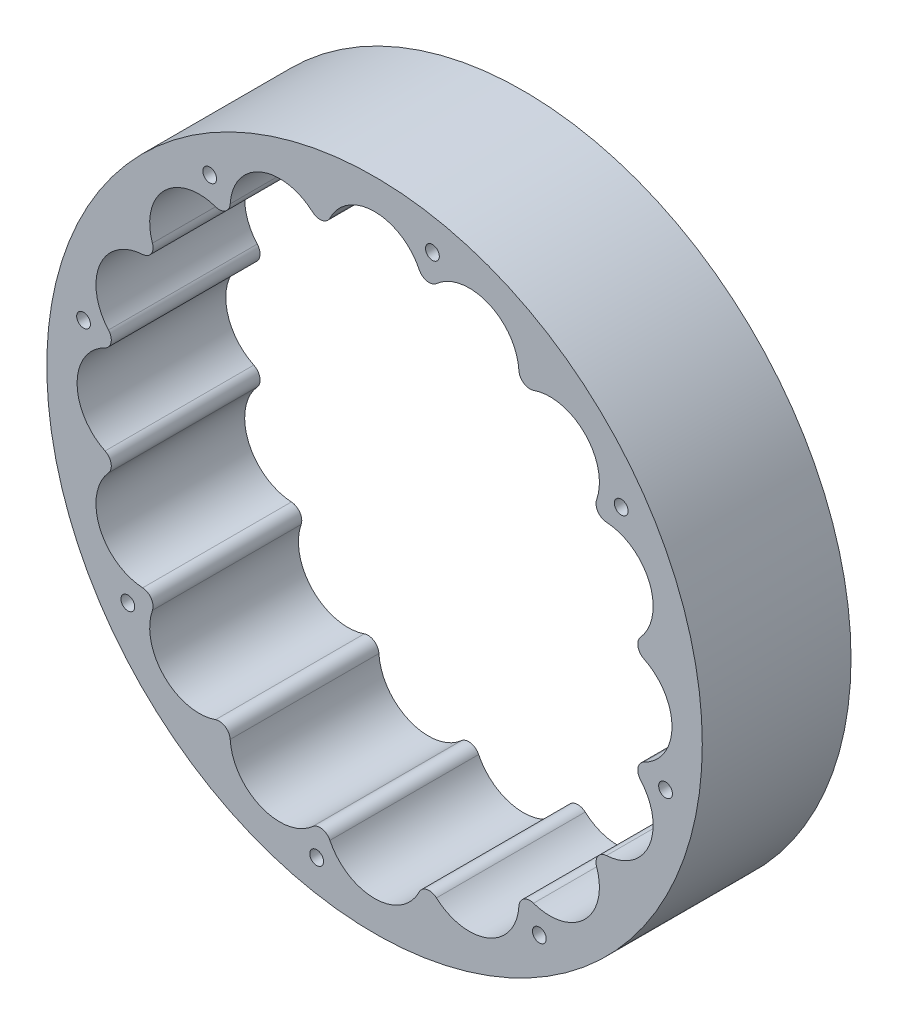
from build123d import *

# Parameters (mm, degrees)
SKETCH1_R           = 59.5
BOSS_EXTRUDE1_DEPTH = 10
SKETCH2_R           = 59.5
BOSS_EXTRUDE3_DEPTH = 27
SKETCH3_R           = 2.025
CUT_EXTRUDE1_DEPTH  = 4
SKETCH4_R           = 23.525
CUT_EXTRUDE2_DEPTH  = 7
SKETCH5_R           = 18
CUT_EXTRUDE3_DEPTH  = 91.755165142
SKETCH6_R           = 1.25
CUT_EXTRUDE4_DEPTH  = 22
FILLET1_R           = 2
SKETCH7_W           = 138.682388438
SKETCH7_H           = 126.163416563
CUT_EXTRUDE5_DEPTH  = 0.01
SKETCH8_R           = 1.5
CUT_EXTRUDE6_DEPTH  = 22
SKETCH9_R           = 58.3
SKETCH9_R_2         = 56.2
CUT_EXTRUDE7_DEPTH  = 2.1


with BuildPart() as part:
    # Sketch1 → Boss-Extrude1 (new body)
    with BuildSketch(Plane.XY):
        Circle(SKETCH1_R)
    extrude(amount=BOSS_EXTRUDE1_DEPTH)

    # Sketch2 → Boss-Extrude3 (add)
    with BuildSketch(Plane.XY.offset(10)):
        Circle(SKETCH2_R)
        with BuildLine():
            ThreePointArc((45.231132339, -8.997031613), (54, 0), (45.231132339, 8.997031613))
            ThreePointArc((45.231132339, 8.997031613), (49.889494756, 20.664905348), (38.345102462, 25.621378334))
            ThreePointArc((38.345102462, 25.621378334), (38.183766184, 38.183766184), (25.621378334, 38.345102462))
            ThreePointArc((25.621378334, 38.345102462), (20.664905348, 49.889494756), (8.997031613, 45.231132339))
            ThreePointArc((8.997031613, 45.231132339), (0, 54), (-8.997031613, 45.231132339))
            ThreePointArc((-8.997031613, 45.231132339), (-20.664905348, 49.889494756), (-25.621378334, 38.345102462))
            ThreePointArc((-25.621378334, 38.345102462), (-38.183766184, 38.183766184), (-38.345102462, 25.621378334))
            ThreePointArc((-38.345102462, 25.621378334), (-49.889494756, 20.664905348), (-45.231132339, 8.997031613))
            ThreePointArc((-45.231132339, 8.997031613), (-54, 0), (-45.231132339, -8.997031613))
            ThreePointArc((-45.231132339, -8.997031613), (-49.889494756, -20.664905348), (-38.345102462, -25.621378334))
            ThreePointArc((-38.345102462, -25.621378334), (-38.183766184, -38.183766184), (-25.621378334, -38.345102462))
            ThreePointArc((-25.621378334, -38.345102462), (-20.664905348, -49.889494756), (-8.997031613, -45.231132339))
            ThreePointArc((-8.997031613, -45.231132339), (0, -54), (8.997031613, -45.231132339))
            ThreePointArc((8.997031613, -45.231132339), (20.664905348, -49.889494756), (25.621378334, -38.345102462))
            ThreePointArc((25.621378334, -38.345102462), (38.183766184, -38.183766184), (38.345102462, -25.621378334))
            ThreePointArc((38.345102462, -25.621378334), (49.889494756, -20.664905348), (45.231132339, -8.997031613))
        make_face(mode=Mode.SUBTRACT)
    extrude(amount=BOSS_EXTRUDE3_DEPTH)

    # Sketch3 → Cut-Extrude1 (cut)
    with BuildSketch(Plane.XY.offset(10)):
        with Locations((45, 0)):
            Circle(SKETCH3_R)
        with Locations((41.574578963, -17.220754456)):
            Circle(SKETCH3_R)
        with Locations((31.819805153, -31.819805153)):
            Circle(SKETCH3_R)
        with Locations((17.220754456, -41.574578963)):
            Circle(SKETCH3_R)
        with Locations((0, -45)):
            Circle(SKETCH3_R)
        with Locations((-17.220754456, -41.574578963)):
            Circle(SKETCH3_R)
        with Locations((-31.819805153, -31.819805153)):
            Circle(SKETCH3_R)
        with Locations((-41.574578963, -17.220754456)):
            Circle(SKETCH3_R)
        with Locations((-45, 0)):
            Circle(SKETCH3_R)
        with Locations((-41.574578963, 17.220754456)):
            Circle(SKETCH3_R)
        with Locations((-31.819805153, 31.819805153)):
            Circle(SKETCH3_R)
        with Locations((-17.220754456, 41.574578963)):
            Circle(SKETCH3_R)
        with Locations((0, 45)):
            Circle(SKETCH3_R)
        with Locations((17.220754456, 41.574578963)):
            Circle(SKETCH3_R)
        with Locations((31.819805153, 31.819805153)):
            Circle(SKETCH3_R)
        with Locations((41.574578963, 17.220754456)):
            Circle(SKETCH3_R)
    extrude(amount=-CUT_EXTRUDE1_DEPTH, mode=Mode.SUBTRACT)

    # Sketch4 → Cut-Extrude2 (cut)
    with BuildSketch(Plane.XY.offset(10)):
        Circle(SKETCH4_R)
    extrude(amount=-CUT_EXTRUDE2_DEPTH, mode=Mode.SUBTRACT)

    # Sketch5 → Cut-Extrude3 (cut, through all)
    with BuildSketch(Plane.XY.offset(3)):
        Circle(SKETCH5_R)
    extrude(amount=-CUT_EXTRUDE3_DEPTH, mode=Mode.SUBTRACT)

    # Sketch6 → Cut-Extrude4 (cut)
    with BuildSketch(Plane.XY.offset(37)):
        with Locations((44.782953319, 29.92301275)):
            Circle(SKETCH6_R)
        with Locations((52.825095203, -10.507564744)):
            Circle(SKETCH6_R)
        with Locations((29.92301275, -44.782953319)):
            Circle(SKETCH6_R)
        with Locations((-10.507564744, -52.825095203)):
            Circle(SKETCH6_R)
        with Locations((-44.782953319, -29.92301275)):
            Circle(SKETCH6_R)
        with Locations((-52.825095203, 10.507564744)):
            Circle(SKETCH6_R)
        with Locations((-29.92301275, 44.782953319)):
            Circle(SKETCH6_R)
        with Locations((10.507564744, 52.825095203)):
            Circle(SKETCH6_R)
    extrude(amount=-CUT_EXTRUDE4_DEPTH, mode=Mode.SUBTRACT)

    # Fillet1
    fillet1_edges = [part.edges().sort_by_distance(p)[0] for p in [
        (45.231132339, -8.997031613, 23.5),
        (45.231132339, 8.997031613, 23.5),
        (38.345102462, 25.621378334, 23.5),
        (25.621378334, 38.345102462, 23.5),
        (8.997031613, 45.231132339, 23.5),
        (-8.997031613, 45.231132339, 23.5),
        (-25.621378334, 38.345102462, 23.5),
        (-38.345102462, 25.621378334, 23.5),
        (-45.231132339, 8.997031613, 23.5),
        (-45.231132339, -8.997031613, 23.5),
        (-38.345102462, -25.621378334, 23.5),
        (-25.621378334, -38.345102462, 23.5),
        (-8.997031613, -45.231132339, 23.5),
        (8.997031613, -45.231132339, 23.5),
        (25.621378334, -38.345102462, 23.5),
        (38.345102462, -25.621378334, 23.5),
    ]]
    fillet(fillet1_edges, radius=FILLET1_R)

    # Sketch7 → Cut-Extrude5 (cut)
    with BuildSketch(Plane.XY.offset(10)):
        with Locations((-4.520739844, -0.904147969)):
            Rectangle(SKETCH7_W, SKETCH7_H)
    extrude(amount=-CUT_EXTRUDE5_DEPTH, mode=Mode.SUBTRACT)


with BuildPart() as cut_extrude5_piece_1:
    # of the separate pieces the step leaves, piece 1, a body of its own (cut_extrude5_pieces)
    add(part.part.solids().sort_by_distance((59.5, 0, 9.99))[0])


with BuildPart() as cut_extrude5_piece_2:
    # of the separate pieces the step leaves, piece 2, a body of its own (cut_extrude5_pieces)
    add(part.part.solids().sort_by_distance((-40.319257579, -28.860192264, 37))[0])

    # Sketch8 → Cut-Extrude6 (cut)
    with BuildSketch(Plane(origin=(0, 0, 10), x_dir=(-1, 0, 0), z_dir=(0, 0, -1))):
        with Locations((44.899359064, 30.000792583)):
            Circle(SKETCH8_R)
        with Locations((52.962405142, -10.534877389)):
            Circle(SKETCH8_R)
        with Locations((30.000792583, -44.899359064)):
            Circle(SKETCH8_R)
        with Locations((-10.534877389, -52.962405142)):
            Circle(SKETCH8_R)
        with Locations((-44.899359064, -30.000792583)):
            Circle(SKETCH8_R)
        with Locations((-52.962405142, 10.534877389)):
            Circle(SKETCH8_R)
        with Locations((-30.000792583, 44.899359064)):
            Circle(SKETCH8_R)
        with Locations((10.534877389, 52.962405142)):
            Circle(SKETCH8_R)
    extrude(amount=-CUT_EXTRUDE6_DEPTH, mode=Mode.SUBTRACT)

    # Sketch9 → Cut-Extrude7 (cut)
    with BuildSketch(Plane(origin=(0, 0, 10), x_dir=(-1, 0, 0), z_dir=(0, 0, -1))):
        Circle(SKETCH9_R)
        Circle(SKETCH9_R_2, mode=Mode.SUBTRACT)
    extrude(amount=-CUT_EXTRUDE7_DEPTH, mode=Mode.SUBTRACT)


solid = cut_extrude5_piece_2.part
